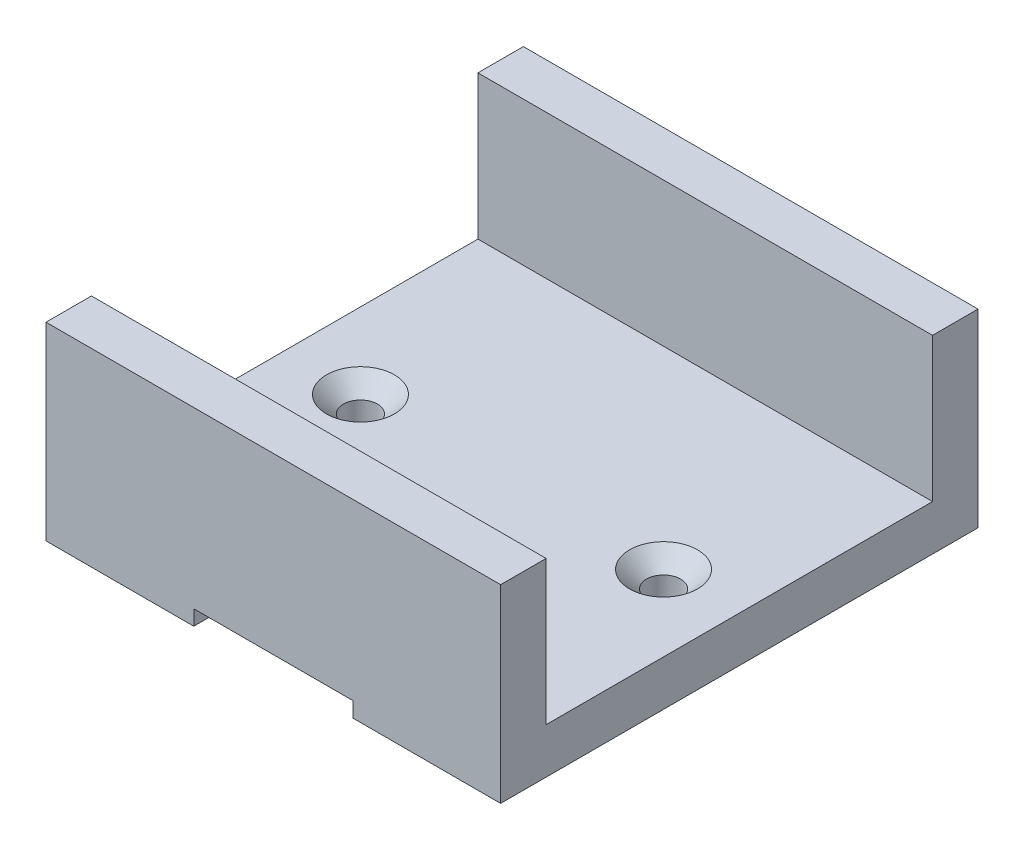
from build123d import *

# Parameters (mm, degrees)
BOSS_EXTRUDE1_DEPTH           = 60
SKETCH2_W                     = 21
SKETCH2_H                     = 2
CUT_EXTRUDE1_DEPTH            = 88.893401345
CSK_FOR_M4_SFHCS1_D           = 4.5
CSK_FOR_M4_SFHCS1_CSINK_D     = 8.96
CSK_FOR_M4_SFHCS1_CSINK_ANGLE = 90


with BuildPart() as part:
    # Sketch1 → Boss-Extrude1 (new body)
    with BuildSketch(Plane(origin=(0, 0, 0), x_dir=(0, 0, -1), z_dir=(1, 0, 0))):
        Polygon((-31.5, 12.5), (-31.5, -12.5), (31.5, -12.5), (31.5, 12.5), (25.5, 12.5), (25.5, -6.5), (-25.5, -6.5), (-25.5, 12.5), align=None)
    extrude(amount=BOSS_EXTRUDE1_DEPTH)

    # Sketch2 → Cut-Extrude1 (cut, through all)
    with BuildSketch(Plane.XY.offset(31.5)):
        with Locations((30, -11.5)):
            Rectangle(SKETCH2_W, SKETCH2_H)
    extrude(amount=-CUT_EXTRUDE1_DEPTH, mode=Mode.SUBTRACT)

    # CSK for M4 SFHCS1 (through all)
    with Locations(Plane(origin=(0, -6.5, 0), x_dir=(1, 0, 0), z_dir=(0, 1, 0))):
        with Locations((10, 0), (50, 0)):
            CounterSinkHole(CSK_FOR_M4_SFHCS1_D / 2, CSK_FOR_M4_SFHCS1_CSINK_D / 2, counter_sink_angle=CSK_FOR_M4_SFHCS1_CSINK_ANGLE)


solid = part.part
